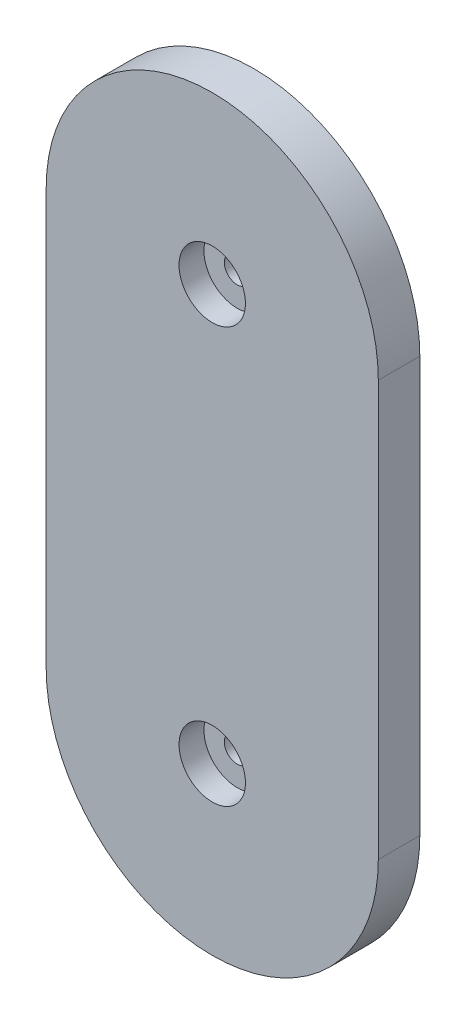
from build123d import *

# Parameters (mm, degrees)
BOSS_EXTRUDE1_DEPTH = 5
SKETCH3_R           = 4
CUT_EXTRUDE1_DEPTH  = 3
SKETCH4_R           = 1.55
CUT_EXTRUDE2_DEPTH  = 22


with BuildPart() as part:
    # Sketch1 → Boss-Extrude1 (new body)
    with BuildSketch(Plane.XY):
        with BuildLine():
            Line((-20, 0), (-20, 50))
            ThreePointArc((-20, 50), (0, 70), (20, 50))
            Line((20, 50), (20, 0))
            ThreePointArc((20, 0), (0, -20), (-20, 0))
        make_face()
    extrude(amount=BOSS_EXTRUDE1_DEPTH)

    # Sketch3 → Cut-Extrude1 (cut)
    with BuildSketch(Plane.XY.offset(5)):
        Circle(SKETCH3_R)
        with Locations(Location((0, 50, 0), (0, 0, 180))):
            Circle(SKETCH3_R)
    extrude(amount=-CUT_EXTRUDE1_DEPTH, mode=Mode.SUBTRACT)

    # Sketch4 → Cut-Extrude2 (cut)
    with BuildSketch(Plane.XY.offset(2)):
        Circle(SKETCH4_R)
        with Locations((0, 50)):
            Circle(SKETCH4_R)
    extrude(amount=-CUT_EXTRUDE2_DEPTH, mode=Mode.SUBTRACT)


solid = part.part
